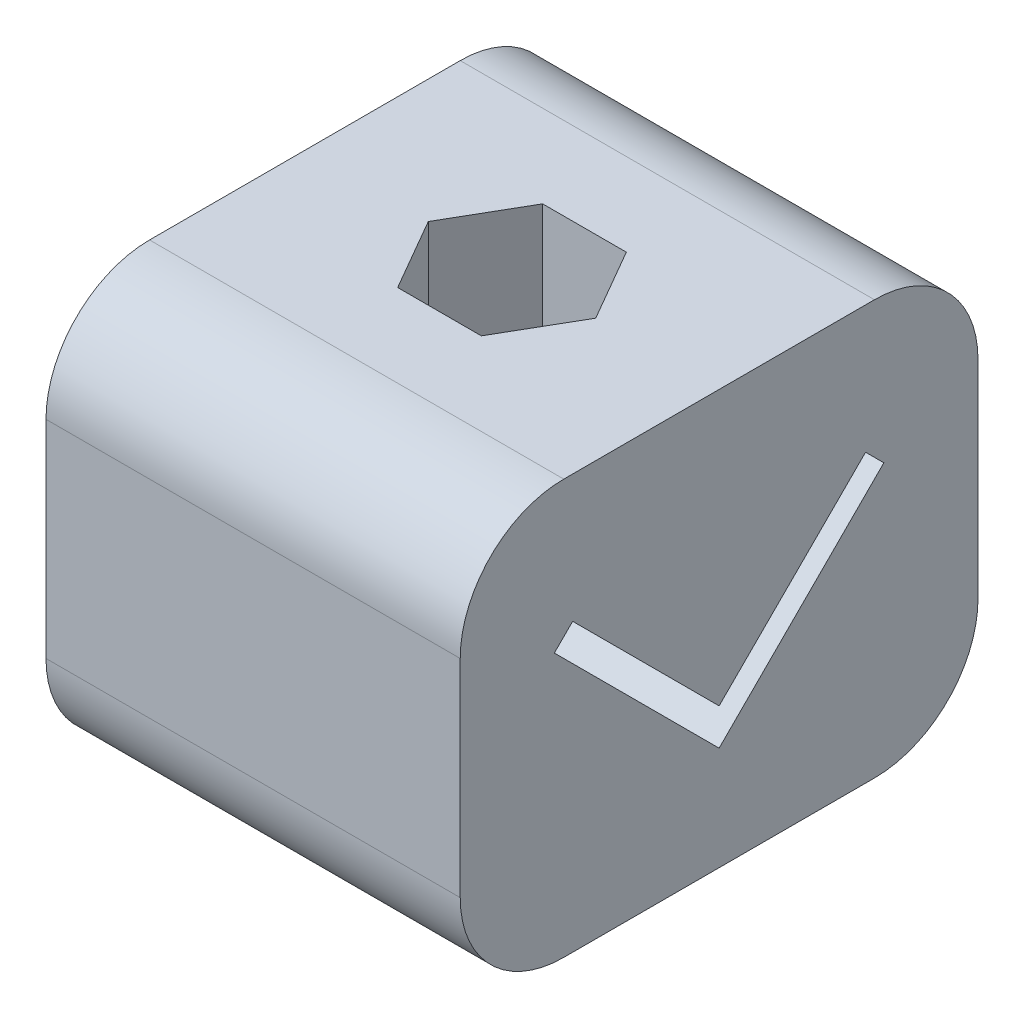
from build123d import *

# Parameters (mm, degrees)
BOSS_EXTRUDE1_DEPTH         = 15.875
CUT_EXTRUDE1_DEPTH          = 152.4
F_1_4_0_25_DIAMETER_HOLE1_D = 3.96875
CUT_EXTRUDE2_DEPTH          = 11.43
SKETCH8_R                   = 4.1275
CUT_EXTRUDE3_DEPTH          = 5.08
FILLET1_R                   = 6.35


with BuildPart() as part:
    # Sketch1 → Boss-Extrude1 (new, symmetric)
    with BuildSketch(Plane.XY):
        Polygon((0, 0), (12.7, 0), (12.7, 25.4), (-12.7, 25.4), (-12.7, 0), align=None)
    extrude(amount=BOSS_EXTRUDE1_DEPTH, both=True)

    # Sketch2 → Cut-Extrude1 (cut)
    with BuildSketch(Plane.ZY.offset(12.7)):
        Polygon((0, 8.59506403), (-8.980256121, 17.575320151), (-10.102788136, 16.452788136), (0, 6.35), (10.102788136, 16.452788136), (8.980256121, 17.575320151), align=None)
    extrude(amount=-CUT_EXTRUDE1_DEPTH, mode=Mode.SUBTRACT)

    # 1/4 (0.25) Diameter Hole1 (through all)
    with Locations(Plane(origin=(0, 25.4, 0), x_dir=(1, 0, 0), z_dir=(0, 1, 0))):
        with Locations((0, 0), (76.2, 0)):
            Hole(F_1_4_0_25_DIAMETER_HOLE1_D / 2)

    # Sketch7 → Cut-Extrude2 (cut)
    with BuildSketch(Plane(origin=(0, 25.4, 0), x_dir=(1, 0, 0), z_dir=(0, 1, 0))):
        Polygon((5.132643893, 0), (2.566321947, 4.445), (-2.566321947, 4.445), (-5.132643893, 0), (-2.566321947, -4.445), (2.566321947, -4.445), align=None)
    extrude(amount=-CUT_EXTRUDE2_DEPTH, mode=Mode.SUBTRACT)

    # Sketch8 → Cut-Extrude3 (cut)
    with BuildSketch(Plane.XZ):
        with Locations(Location((0, 0, 0), (0, 0, 270))):
            Circle(SKETCH8_R)
    extrude(amount=-CUT_EXTRUDE3_DEPTH, mode=Mode.SUBTRACT)

    # Fillet1
    fillet1_edges = [part.edges().sort_by_distance(p)[0] for p in [
        (0, 25.4, 15.875),
        (0, 0, 15.875),
        (0, 25.4, -15.875),
        (0, 0, -15.875),
    ]]
    fillet(fillet1_edges, radius=FILLET1_R)


solid = part.part
